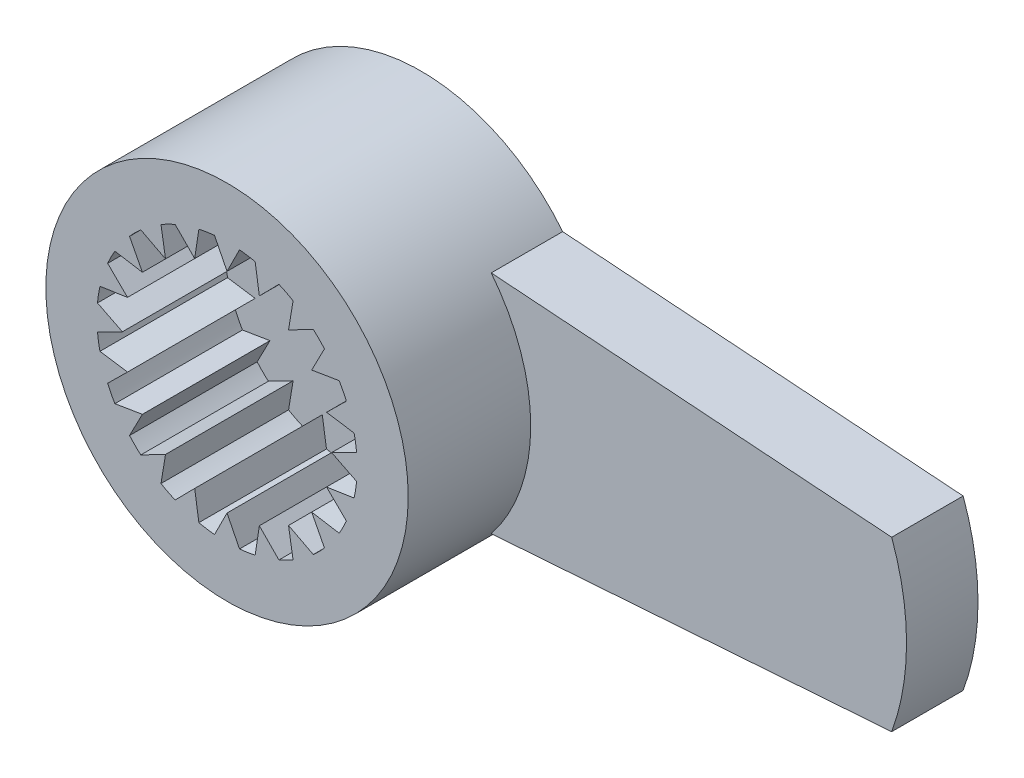
from build123d import *

# Parameters (mm, degrees)
SKETCH2_R           = 3.55
BOSS_EXTRUDE1_DEPTH = 3.8
BOSS_EXTRUDE2_DEPTH = 1.4
SKETCH5_R           = 2.549999919
CUT_EXTRUDE1_DEPTH  = 2.5
BOSS_EXTRUDE3_DEPTH = 2.5


with BuildPart() as part:
    # Sketch2 → Boss-Extrude1 (new body)
    with BuildSketch(Plane.XY):
        Circle(SKETCH2_R)
    extrude(amount=-BOSS_EXTRUDE1_DEPTH)

    # Sketch4 → Boss-Extrude2 (add)
    with BuildSketch(Plane.XY.offset(-2.4)):
        with BuildLine():
            Line((2.776387215, 2.212277889), (10.622617722, 1.649999976))
            ThreePointArc((10.622617722, 1.649999976), (10.913548722, 0), (10.622617722, -1.649999976))
            Line((10.622617722, -1.649999976), (2.776387215, -2.212277889))
            ThreePointArc((2.776387215, -2.212277889), (3.549999952, 0), (2.776387215, 2.212277889))
        make_face()
    extrude(amount=-BOSS_EXTRUDE2_DEPTH)

    # Sketch5 → Cut-Extrude1 (cut)
    with BuildSketch(Plane.XY):
        Circle(SKETCH5_R)
    extrude(amount=-CUT_EXTRUDE1_DEPTH, mode=Mode.SUBTRACT)

    # Sketch3 → Boss-Extrude3 (add)
    with BuildSketch(Plane.XY):
        with BuildLine():
            Line((-0.244697916, 2.538232164), (0, 2.049999952))
            Line((0, 2.049999952), (0.244697916, 2.538232164))
            ThreePointArc((0.244697916, 2.538232164), (0, 2.549999919), (-0.244697916, 2.538232164))
        make_face()
        with BuildLine():
            Line((0.551635326, 2.489618054), (0.633484824, 1.949665813))
            Line((0.633484824, 1.949665813), (1.017078422, 2.338386424))
            ThreePointArc((1.017078422, 2.338386424), (0.787993311, 2.42519404), (0.551635326, 2.489618054))
        make_face()
        with BuildLine():
            Line((1.29397066, 2.197302783), (1.204959739, 1.6584848))
            Line((1.204959739, 1.6584848), (1.689900206, 1.90964313))
            ThreePointArc((1.689900206, 1.90964313), (1.498852346, 2.06299327), (1.29397066, 2.197302783))
        make_face()
        with BuildLine():
            Line((1.90964313, 1.689900206), (1.6584848, 1.204959739))
            Line((1.6584848, 1.204959739), (2.197302783, 1.29397066))
            ThreePointArc((2.197302783, 1.29397066), (2.06299327, 1.498852346), (1.90964313, 1.689900206))
        make_face()
        with BuildLine():
            Line((2.338386424, 1.017078422), (1.949665813, 0.633484824))
            Line((1.949665813, 0.633484824), (2.489618054, 0.551635326))
            ThreePointArc((2.489618054, 0.551635326), (2.42519404, 0.787993311), (2.338386424, 1.017078422))
        make_face()
        with BuildLine():
            Line((2.538232164, 0.244697916), (2.049999952, 0))
            Line((2.049999952, 0), (2.538232164, -0.244697916))
            ThreePointArc((2.538232164, -0.244697916), (2.549999919, 0), (2.538232164, 0.244697916))
        make_face()
        with BuildLine():
            Line((2.489618054, -0.551635326), (1.949665813, -0.633484824))
            Line((1.949665813, -0.633484824), (2.338386424, -1.017078422))
            ThreePointArc((2.338386424, -1.017078422), (2.42519404, -0.787993311), (2.489618054, -0.551635326))
        make_face()
        with BuildLine():
            Line((2.197302783, -1.29397066), (1.6584848, -1.204959739))
            Line((1.6584848, -1.204959739), (1.90964313, -1.689900206))
            ThreePointArc((1.90964313, -1.689900206), (2.06299327, -1.498852346), (2.197302783, -1.29397066))
        make_face()
        with BuildLine():
            Line((1.689900206, -1.90964313), (1.204959739, -1.6584848))
            Line((1.204959739, -1.6584848), (1.29397066, -2.197302783))
            ThreePointArc((1.29397066, -2.197302783), (1.498852346, -2.06299327), (1.689900206, -1.90964313))
        make_face()
        with BuildLine():
            Line((1.017078422, -2.338386424), (0.633484824, -1.949665813))
            Line((0.633484824, -1.949665813), (0.551635326, -2.489618054))
            ThreePointArc((0.551635326, -2.489618054), (0.787993311, -2.42519404), (1.017078422, -2.338386424))
        make_face()
        with BuildLine():
            Line((0.244697916, -2.538232164), (0, -2.049999952))
            Line((0, -2.049999952), (-0.244697916, -2.538232164))
            ThreePointArc((-0.244697916, -2.538232164), (0, -2.549999919), (0.244697916, -2.538232164))
        make_face()
        with BuildLine():
            Line((-0.551635326, -2.489618054), (-0.633484824, -1.949665813))
            Line((-0.633484824, -1.949665813), (-1.017078422, -2.338386424))
            ThreePointArc((-1.017078422, -2.338386424), (-0.787993311, -2.42519404), (-0.551635326, -2.489618054))
        make_face()
        with BuildLine():
            Line((-1.29397066, -2.197302783), (-1.204959739, -1.6584848))
            Line((-1.204959739, -1.6584848), (-1.689900206, -1.90964313))
            ThreePointArc((-1.689900206, -1.90964313), (-1.498852346, -2.06299327), (-1.29397066, -2.197302783))
        make_face()
        with BuildLine():
            Line((-1.90964313, -1.689900206), (-1.6584848, -1.204959739))
            Line((-1.6584848, -1.204959739), (-2.197302783, -1.29397066))
            ThreePointArc((-2.197302783, -1.29397066), (-2.06299327, -1.498852346), (-1.90964313, -1.689900206))
        make_face()
        with BuildLine():
            Line((-2.338386424, -1.017078422), (-1.949665813, -0.633484824))
            Line((-1.949665813, -0.633484824), (-2.489618054, -0.551635326))
            ThreePointArc((-2.489618054, -0.551635326), (-2.42519404, -0.787993311), (-2.338386424, -1.017078422))
        make_face()
        with BuildLine():
            Line((-2.538232164, -0.244697916), (-2.049999952, 0))
            Line((-2.049999952, 0), (-2.538232164, 0.244697916))
            ThreePointArc((-2.538232164, 0.244697916), (-2.549999919, 0), (-2.538232164, -0.244697916))
        make_face()
        with BuildLine():
            Line((-2.489618054, 0.551635326), (-1.949665813, 0.633484824))
            Line((-1.949665813, 0.633484824), (-2.338386424, 1.017078422))
            ThreePointArc((-2.338386424, 1.017078422), (-2.42519404, 0.787993311), (-2.489618054, 0.551635326))
        make_face()
        with BuildLine():
            Line((-2.197302783, 1.29397066), (-1.6584848, 1.204959739))
            Line((-1.6584848, 1.204959739), (-1.90964313, 1.689900206))
            ThreePointArc((-1.90964313, 1.689900206), (-2.06299327, 1.498852346), (-2.197302783, 1.29397066))
        make_face()
        with BuildLine():
            Line((-1.689900206, 1.90964313), (-1.204959739, 1.6584848))
            Line((-1.204959739, 1.6584848), (-1.29397066, 2.197302783))
            ThreePointArc((-1.29397066, 2.197302783), (-1.498852346, 2.06299327), (-1.689900206, 1.90964313))
        make_face()
        with BuildLine():
            Line((-1.017078422, 2.338386424), (-0.633484824, 1.949665813))
            Line((-0.633484824, 1.949665813), (-0.551635326, 2.489618054))
            ThreePointArc((-0.551635326, 2.489618054), (-0.787993311, 2.42519404), (-1.017078422, 2.338386424))
        make_face()
    extrude(amount=-BOSS_EXTRUDE3_DEPTH)


solid = part.part
